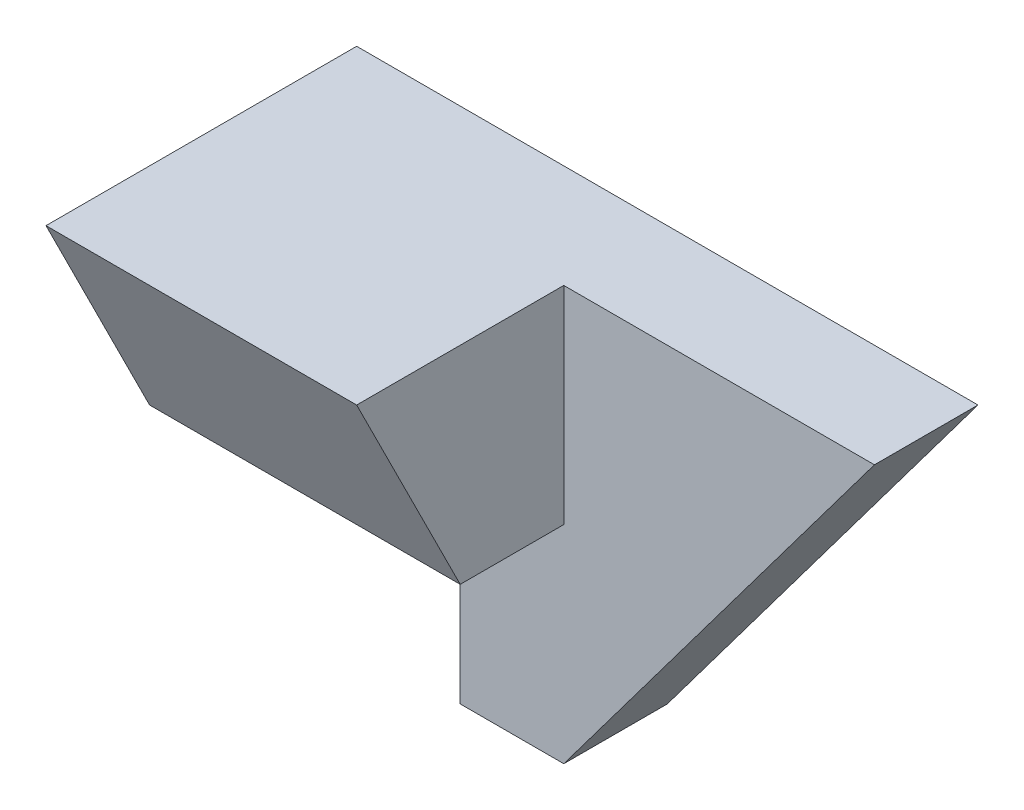
from build123d import *

# Parameters (mm, degrees)
DODANIE_WYCI_GNI_CIE1_DEPTH = 10
SZKIC2_W                    = 30
SZKIC2_H                    = 20
DODANIE_WYCI_GNI_CIE2_DEPTH = 20
WYTNIJ_WYCI_GNI_CIE1_DEPTH  = 43


with BuildPart() as part:
    # Szkic1 → Dodanie-wyciągnięcie1 (new body)
    with BuildSketch(Plane.XY):
        Polygon((0, 0), (0, -30), (20, -30), (20, -40), (30, -40), (60, 0), align=None)
    extrude(amount=DODANIE_WYCI_GNI_CIE1_DEPTH)

    # Szkic2 → Dodanie-wyciągnięcie2 (add)
    with BuildSketch(Plane.XY.offset(10)):
        with Locations((15, -10)):
            Rectangle(SZKIC2_W, SZKIC2_H)
    extrude(amount=DODANIE_WYCI_GNI_CIE2_DEPTH)

    # Szkic3 → Wytnij-wyciągnięcie1 (cut)
    with BuildSketch(Plane(origin=(30, 0, 0), x_dir=(0, 0, -1), z_dir=(1, 0, 0))):
        Polygon((-30, -20), (-20, -20), (-30, 0), align=None)
    extrude(amount=-WYTNIJ_WYCI_GNI_CIE1_DEPTH, mode=Mode.SUBTRACT)


solid = part.part
